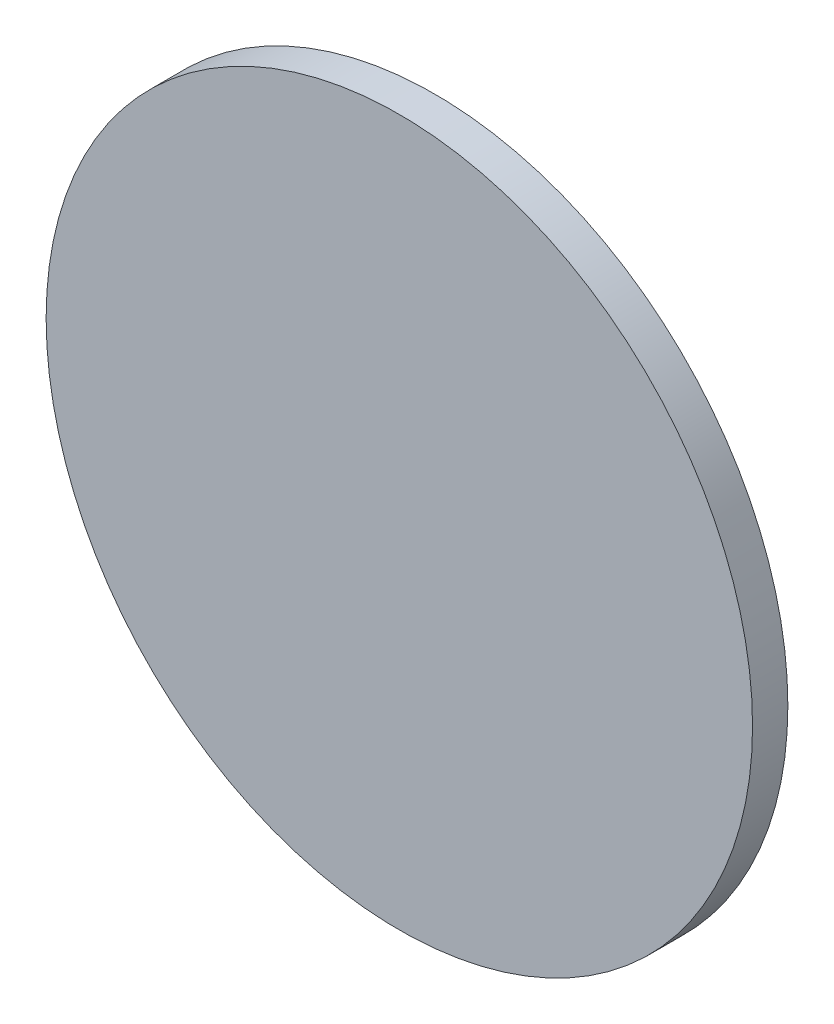
from build123d import *

# Parameters (mm, degrees)
SKETCH2_R           = 40
BOSS_EXTRUDE1_DEPTH = 4


with BuildPart() as part:
    # Sketch2 → Boss-Extrude1 (new body)
    with BuildSketch(Plane.XY):
        Circle(SKETCH2_R)
    extrude(amount=BOSS_EXTRUDE1_DEPTH)


solid = part.part
